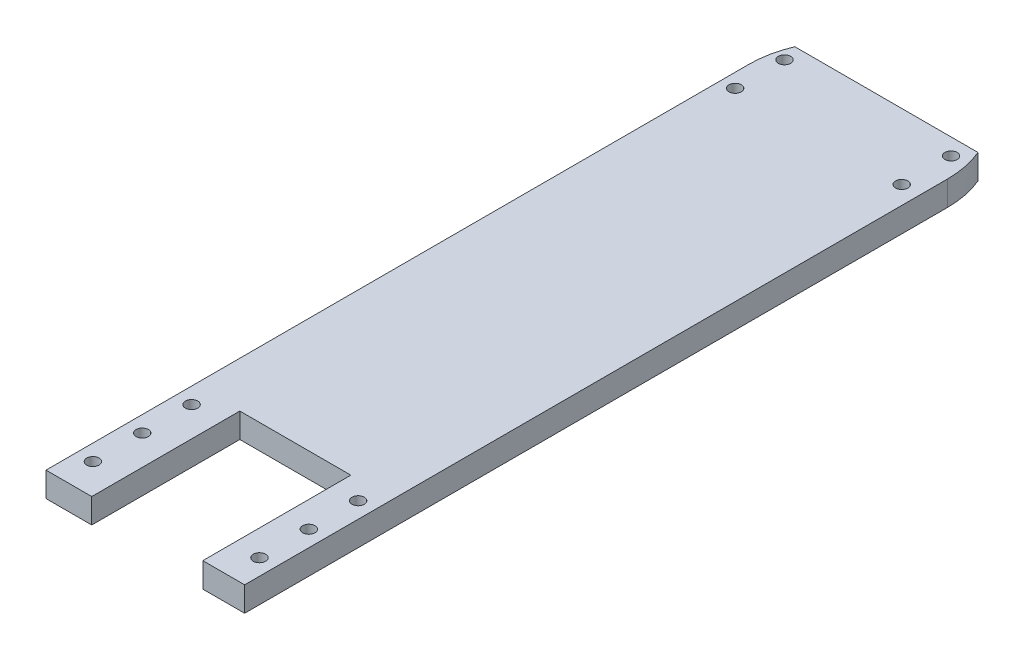
from build123d import *

# Parameters (mm, degrees)
BOSS_EXTRU_1_DEPTH      = 4
ESQUISSE2_R             = 1
ESQUISSE2_W             = 29.690189182
ESQUISSE2_H             = 17.433113391
ENL_V_MAT_EXTRU_1_DEPTH = 4
ESQUISSE4_W             = 18
ESQUISSE4_H             = 24
ENL_V_MAT_EXTRU_2_DEPTH = 10


with BuildPart() as part:
    # Esquisse1 → Boss.-Extru.1 (new body)
    with BuildSketch(Plane(origin=(0, 0, 0), x_dir=(1, 0, 0), z_dir=(0, 1, 0))):
        with BuildLine():
            Line((-16.1, 0), (-16.1, -113.9))
            Line((-16.1, -113.9), (16.1, -113.9))
            Line((16.1, -113.9), (16.1, 0))
            ThreePointArc((16.1, 0), (0, 16.1), (-16.1, 0))
        make_face()
    extrude(amount=BOSS_EXTRU_1_DEPTH)

    # Esquisse2 → Enlèv. mat.-Extru.1 (cut)
    with BuildSketch(Plane(origin=(0, 4, 0), x_dir=(1, 0, 0), z_dir=(0, 1, 0))):
        with Locations(Location((-13.5, -92.9, 0), (0, 0, 270))):
            Circle(ESQUISSE2_R)
        with Locations(Location((-13.5, -100.9, 0), (0, 0, 270))):
            Circle(ESQUISSE2_R)
        with Locations(Location((13.5, -92.9, 0), (0, 0, 270))):
            Circle(ESQUISSE2_R)
        with Locations(Location((13.5, -100.9, 0), (0, 0, 270))):
            Circle(ESQUISSE2_R)
        with Locations(Location((13.5, -108.9, 0), (0, 0, 270))):
            Circle(ESQUISSE2_R)
        with Locations(Location((-13.5, -108.9, 0), (0, 0, 270))):
            Circle(ESQUISSE2_R)
        with Locations(Location((13.154905409, -4.448481213, 0), (0, 0, 270))):
            Circle(ESQUISSE2_R)
        with Locations(Location((-13.845094591, 3.551518787, 0), (0, 0, 270))):
            Circle(ESQUISSE2_R)
        with Locations(Location((-13.845094591, -4.448481213, 0), (0, 0, 270))):
            Circle(ESQUISSE2_R)
        with Locations(Location((13.154905409, 3.551518787, 0), (0, 0, 270))):
            Circle(ESQUISSE2_R)
        with Locations((0, 14.948183015)):
            Rectangle(ESQUISSE2_W, ESQUISSE2_H)
    extrude(amount=-ENL_V_MAT_EXTRU_1_DEPTH, mode=Mode.SUBTRACT)

    # Esquisse4 → Enlèv. mat.-Extru.2 (cut)
    with BuildSketch(Plane(origin=(0, 4, 0), x_dir=(1, 0, 0), z_dir=(0, 1, 0))):
        with Locations((0.316024011, -101.9)):
            Rectangle(ESQUISSE4_W, ESQUISSE4_H)
    extrude(amount=-ENL_V_MAT_EXTRU_2_DEPTH, mode=Mode.SUBTRACT)


solid = part.part
